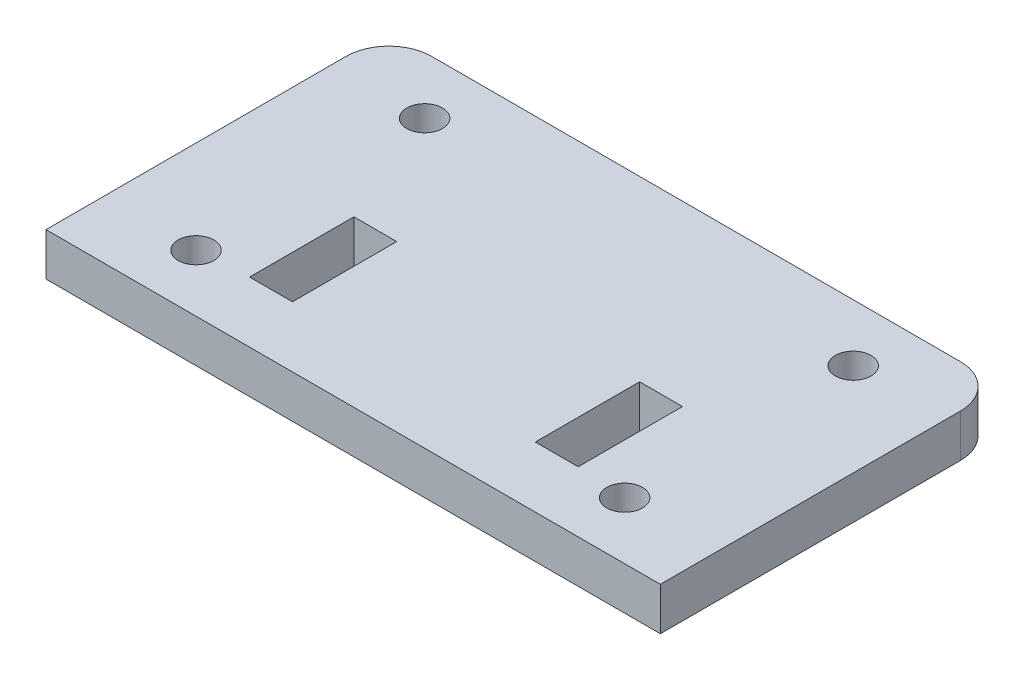
from build123d import *

# Parameters (mm, degrees)
ESQUISSE1_R        = 1.25
ESQUISSE1_W        = 3
ESQUISSE1_H        = 7.3
BOSS_EXTRU_1_DEPTH = 3


with BuildPart() as part:
    # Esquisse1 → Boss.-Extru.1 (new body)
    with BuildSketch(Plane(origin=(0, 0, 0), x_dir=(1, 0, 0), z_dir=(0, 1, 0))):
        with BuildLine():
            Line((-18.5, 24), (18.5, 24))
            ThreePointArc((18.5, 24), (20.621320344, 23.121320344), (21.5, 21))
            Line((21.5, 21), (21.5, 0))
            Line((21.5, 0), (-21.5, 0))
            Line((-21.5, 0), (-21.5, 21))
            ThreePointArc((-21.5, 21), (-20.621320344, 23.121320344), (-18.5, 24))
        make_face()
        with Locations(Location((-15, 20, 0), (0, 0, 270))):
            Circle(ESQUISSE1_R, mode=Mode.SUBTRACT)
        with Locations(Location((15, 20, 0), (0, 0, 270))):
            Circle(ESQUISSE1_R, mode=Mode.SUBTRACT)
        with Locations(Location((15, 4, 0), (0, 0, 270))):
            Circle(ESQUISSE1_R, mode=Mode.SUBTRACT)
        with Locations(Location((-15, 4, 0), (0, 0, 270))):
            Circle(ESQUISSE1_R, mode=Mode.SUBTRACT)
        with Locations((-10, 7.9)):
            Rectangle(ESQUISSE1_W, ESQUISSE1_H, mode=Mode.SUBTRACT)
        with Locations((10, 7.9)):
            Rectangle(ESQUISSE1_W, ESQUISSE1_H, mode=Mode.SUBTRACT)
    extrude(amount=BOSS_EXTRU_1_DEPTH)


solid = part.part
